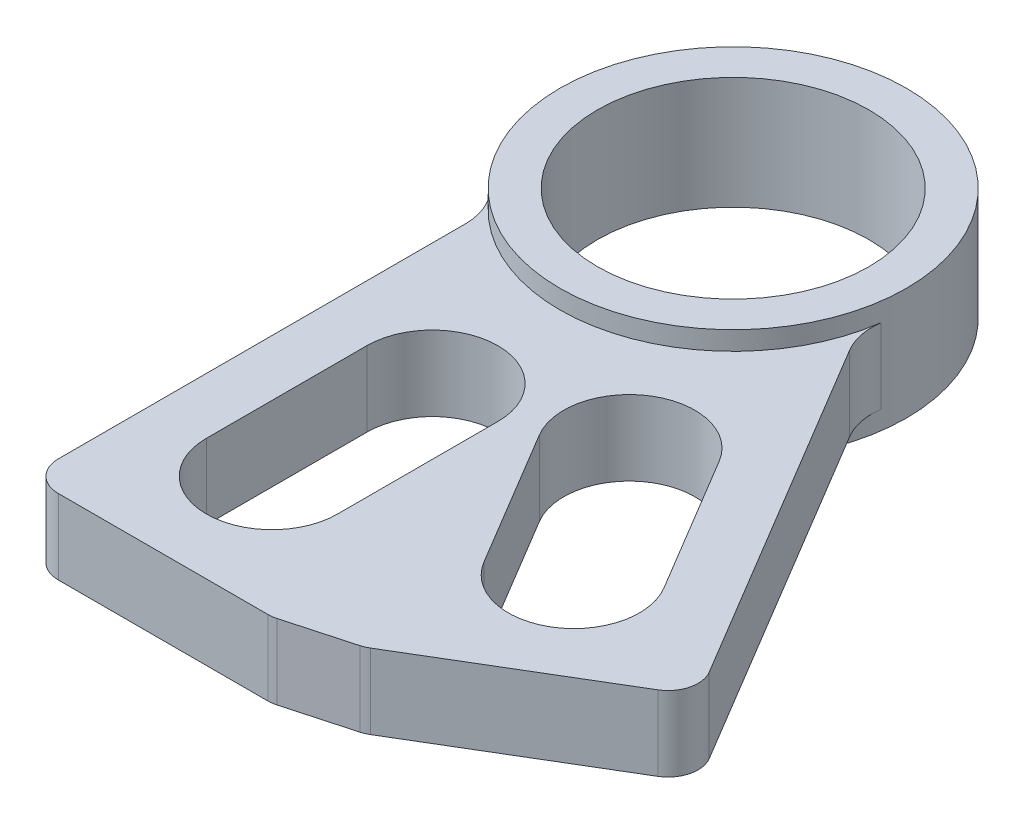
from build123d import *

# Parameters (mm, degrees)
SKETCH1_R                      = 14.6812
SKETCH1_R_2                    = 11.5062
BEARING_INSERT_EXTRUDE_DEPTH   = 4.7625
APEX_SLOT_INSERT_EXTRUDE_DEPTH = 3.175
FILLET1_R                      = 5.08
FILLET2_R                      = 2.54


with BuildPart() as part:
    # Sketch1 → Bearing_Insert_Extrude (new, symmetric)
    with BuildSketch(Plane(origin=(0, 0, 0), x_dir=(1, 0, 0), z_dir=(0, 1, 0))):
        with Locations(Location((0, 0, 0), (0, 0, 90))):
            Circle(SKETCH1_R)
        with Locations(Location((0, 0, 0), (0, 0, 90))):
            Circle(SKETCH1_R_2, mode=Mode.SUBTRACT)
    extrude(amount=BEARING_INSERT_EXTRUDE_DEPTH, both=True)

    # Sketch1<4> → Apex_Slot_Insert_Extrude (add, symmetric)
    # profile 1 of 2: a face of its own
    with BuildSketch(Plane(origin=(0, 0, 0), x_dir=(1, 0, 0), z_dir=(0, 1, 0))):
        with BuildLine():
            Line((-10.31875, -10.443228997), (-10.31875, -49.3903))
            Line((-10.31875, -49.3903), (10.31875, -49.3903))
            Line((10.31875, -49.3903), (10.31875, -37.377378924))
            Line((10.31875, -37.377378924), (16.481834274, -47.688861117))
            Line((16.481834274, -47.688861117), (34.196361191, -37.101040645))
            Line((34.196361191, -37.101040645), (14.215036143, -3.670201753))
            ThreePointArc((14.215036143, -3.670201753), (3.906883149, -14.15181605), (-10.31875, -10.443228997))
        make_face()
        with BuildLine():
            ThreePointArc((5.55625, -39.07155), (0, -44.6278), (-5.55625, -39.07155))
            Line((-5.55625, -39.07155), (-5.55625, -25.48255))
            ThreePointArc((-5.55625, -25.48255), (0, -19.9263), (5.55625, -25.48255))
            Line((5.55625, -25.48255), (5.55625, -39.07155))
        make_face(mode=Mode.SUBTRACT)
        with BuildLine():
            ThreePointArc((24.814483205, -30.687120372), (22.895754546, -38.306983131), (15.275891788, -36.388254472))
            Line((15.275891788, -36.388254472), (8.304219231, -24.723919825))
            ThreePointArc((8.304219231, -24.723919825), (10.222947889, -17.104057067), (17.842810648, -19.022785725))
            Line((17.842810648, -19.022785725), (24.814483205, -30.687120372))
        make_face(mode=Mode.SUBTRACT)
    # profile 2 of 2: a face of its own
    with BuildSketch(Plane(origin=(0, 0, 0), x_dir=(1, 0, 0), z_dir=(0, 1, 0))):
        Polygon((10.31875, -49.3903), (10.31875, -37.377378924), (16.481834274, -47.688861117), align=None)
    extrude(amount=APEX_SLOT_INSERT_EXTRUDE_DEPTH, both=True)

    # Fillet1
    fillet1_edges = [part.edges().sort_by_distance(p)[0] for p in [
        (14.215036143, 0, 3.670201753),
        (-10.31875, 0, 10.443228997),
    ]]
    fillet(fillet1_edges, radius=FILLET1_R)

    # Fillet2
    fillet2_edges = [part.edges().sort_by_distance(p)[0] for p in [
        (-10.31875, 0, 49.3903),
        (10.31875, 0, 49.3903),
        (16.481834274, 0, 47.688861117),
        (34.196361191, 0, 37.101040645),
    ]]
    fillet(fillet2_edges, radius=FILLET2_R)


solid = part.part
